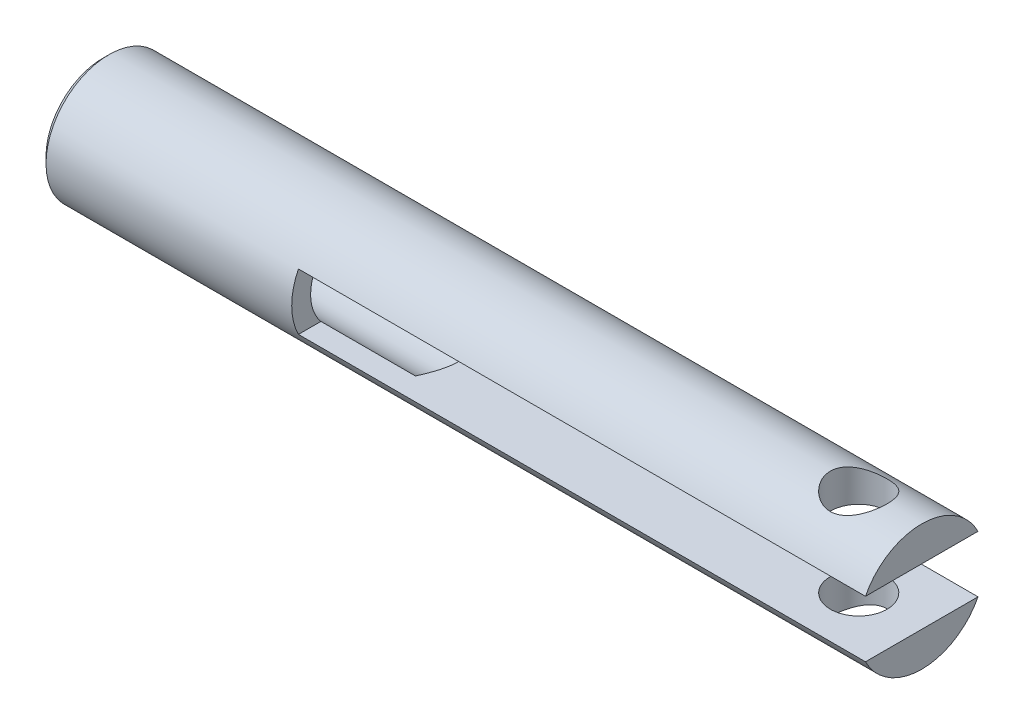
from build123d import *

# Parameters (mm, degrees)
ESQUISSE2_R             = 4.5
ENL_V_MAT_EXTRU_1_DEPTH = 132.909059583
ESQUISSE3_W             = 90
ESQUISSE3_H             = 20
ENL_V_MAT_EXTRU_2_DEPTH = 4.5


with BuildPart() as part:
    # Esquisse1 → Base-Révolution (revolve)
    with BuildSketch(Plane.XY, mode=Mode.PRIVATE) as base_r_volution_sk:
        Polygon((0, 7), (0, 9), (1, 10), (130, 10), (130, 0), (59.041451884, 0), (55, 7), align=None)
    revolve(base_r_volution_sk.sketch.rotate(Axis((0, 0, 0), (1, 0, 0)), 90), axis=Axis((0, 0, 0), (1, 0, 0)))

    # Esquisse2 → Enlèv. mat.-Extru.1 (cut, through all)
    with BuildSketch(Plane(origin=(0, 10, 0), x_dir=(-1, 0, 0), z_dir=(0, 1, 0))):
        with Locations(Location((-120, 0, 0), (0, 0, 90))):
            Circle(ESQUISSE2_R)
    extrude(amount=-ENL_V_MAT_EXTRU_1_DEPTH, mode=Mode.SUBTRACT)

    # Esquisse3 → Enlèv. mat.-Extru.2 (cut, symmetric)
    with BuildSketch(Plane(origin=(0, 0, 0), x_dir=(1, 0, 0), z_dir=(0, 1, 0))):
        with Locations((85, 0)):
            Rectangle(ESQUISSE3_W, ESQUISSE3_H)
    extrude(amount=ENL_V_MAT_EXTRU_2_DEPTH, both=True, mode=Mode.SUBTRACT)


solid = part.part
